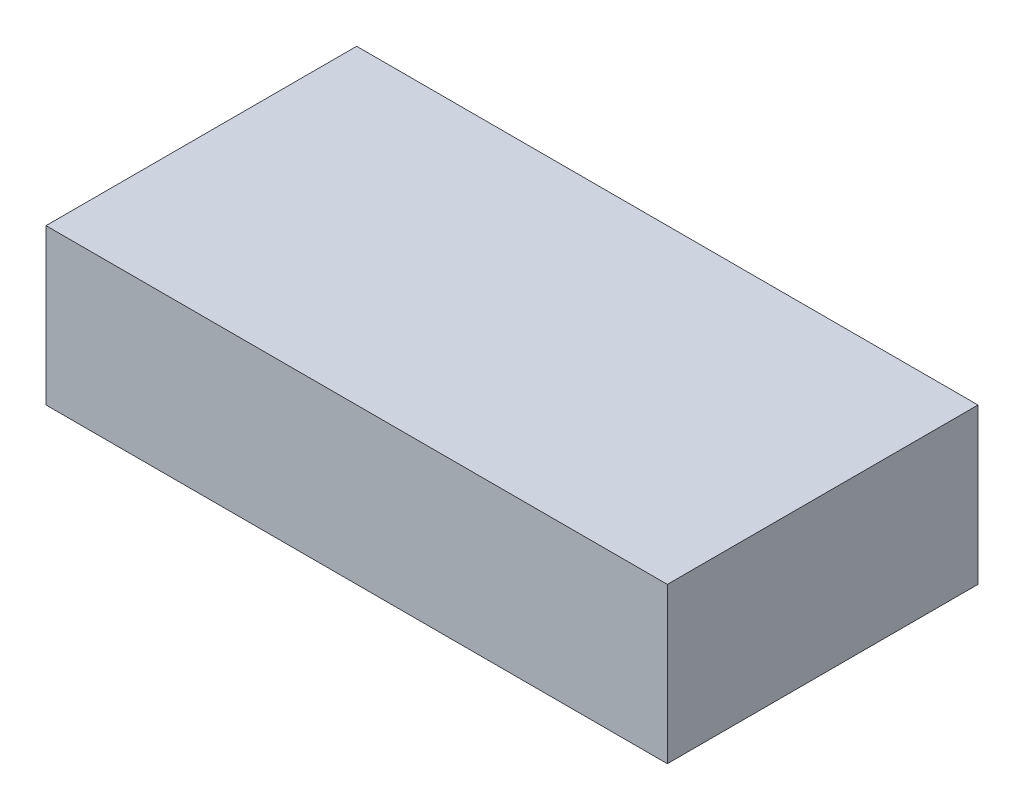
from build123d import *

# Parameters (mm, degrees)
SKETCH1_W           = 40
SKETCH1_H           = 20
BOSS_EXTRUDE1_DEPTH = 5


with BuildPart() as part:
    # Sketch1 → Boss-Extrude1 (new, symmetric)
    with BuildSketch(Plane(origin=(0, 0, 0), x_dir=(1, 0, 0), z_dir=(0, 1, 0))):
        with Locations((20, 10)):
            Rectangle(SKETCH1_W, SKETCH1_H)
    extrude(amount=BOSS_EXTRUDE1_DEPTH, both=True)


solid = part.part
